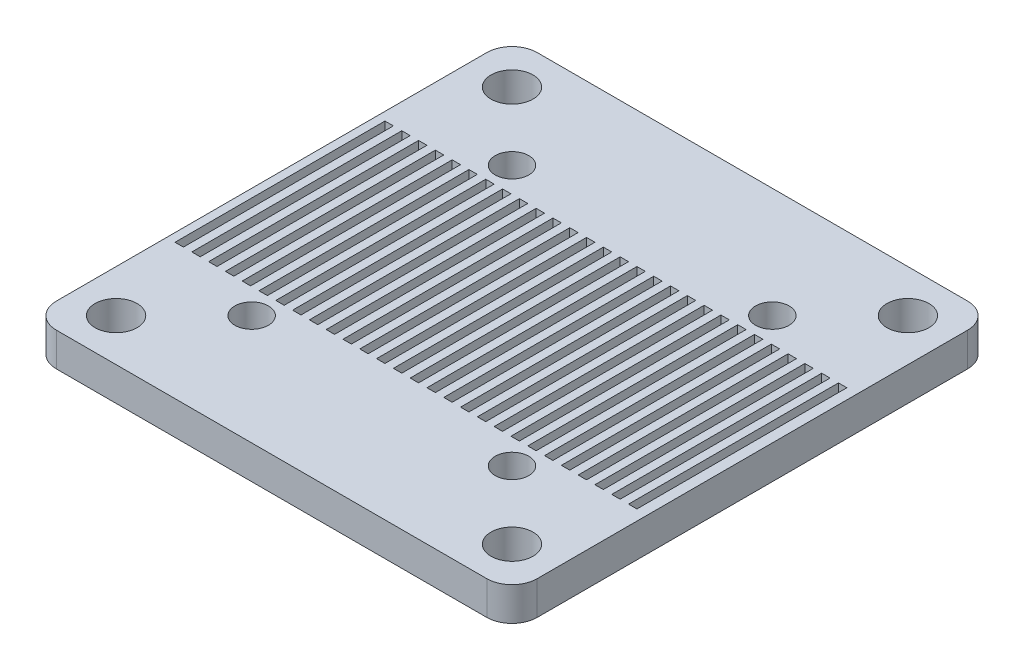
from build123d import *

# Parameters (mm, degrees)
SKETCH1_R           = 2
SKETCH1_R_2         = 2.5
BOSS_EXTRUDE1_DEPTH = 4
SKETCH2_W           = 1
SKETCH2_H           = 25
CUT_EXTRUDE1_DEPTH  = 1


with BuildPart() as part:
    # Sketch1 → Boss-Extrude1 (new body)
    with BuildSketch(Plane(origin=(0, 0, 0), x_dir=(1, 0, 0), z_dir=(0, 1, 0))):
        with BuildLine():
            Line((25.625, 28.625), (-25.625, 28.625))
            ThreePointArc((-25.625, 28.625), (-27.746320344, 27.746320344), (-28.625, 25.625))
            Line((-28.625, 25.625), (-28.625, -25.625))
            ThreePointArc((-28.625, -25.625), (-27.746320344, -27.746320344), (-25.625, -28.625))
            Line((-25.625, -28.625), (25.625, -28.625))
            ThreePointArc((25.625, -28.625), (27.746320344, -27.746320344), (28.625, -25.625))
            Line((28.625, -25.625), (28.625, 25.625))
            ThreePointArc((28.625, 25.625), (27.746320344, 27.746320344), (25.625, 28.625))
        make_face()
        with Locations(Location((-15.5, 15.5, 0), (0, 0, 270))):
            Circle(SKETCH1_R, mode=Mode.SUBTRACT)
        with Locations(Location((-23.57, 23.57, 0), (0, 0, 270))):
            Circle(SKETCH1_R_2, mode=Mode.SUBTRACT)
        with Locations(Location((23.57, 23.57, 0), (0, 0, 270))):
            Circle(SKETCH1_R_2, mode=Mode.SUBTRACT)
        with Locations(Location((15.5, 15.5, 0), (0, 0, 270))):
            Circle(SKETCH1_R, mode=Mode.SUBTRACT)
        with Locations(Location((15.5, -15.5, 0), (0, 0, 270))):
            Circle(SKETCH1_R, mode=Mode.SUBTRACT)
        with Locations(Location((-15.5, -15.5, 0), (0, 0, 270))):
            Circle(SKETCH1_R, mode=Mode.SUBTRACT)
        with Locations(Location((-23.57, -23.57, 0), (0, 0, 270))):
            Circle(SKETCH1_R_2, mode=Mode.SUBTRACT)
        with Locations(Location((23.57, -23.57, 0), (0, 0, 270))):
            Circle(SKETCH1_R_2, mode=Mode.SUBTRACT)
    extrude(amount=BOSS_EXTRUDE1_DEPTH)

    # Sketch2 → Cut-Extrude1 (cut)
    with BuildSketch(Plane(origin=(0, 4, 0), x_dir=(1, 0, 0), z_dir=(0, 1, 0))):
        with Locations((-27.125, 0)):
            Rectangle(SKETCH2_W, SKETCH2_H)
        with Locations((-25.125, 0)):
            Rectangle(SKETCH2_W, SKETCH2_H)
        with Locations((-23.125, 0)):
            Rectangle(SKETCH2_W, SKETCH2_H)
        with Locations((-21.125, 0)):
            Rectangle(SKETCH2_W, SKETCH2_H)
        with Locations((-19.125, 0)):
            Rectangle(SKETCH2_W, SKETCH2_H)
        with Locations((-17.125, 0)):
            Rectangle(SKETCH2_W, SKETCH2_H)
        with Locations((-15.125, 0)):
            Rectangle(SKETCH2_W, SKETCH2_H)
        with Locations((-13.125, 0)):
            Rectangle(SKETCH2_W, SKETCH2_H)
        with Locations((-11.125, 0)):
            Rectangle(SKETCH2_W, SKETCH2_H)
        with Locations((-9.125, 0)):
            Rectangle(SKETCH2_W, SKETCH2_H)
        with Locations((-7.125, 0)):
            Rectangle(SKETCH2_W, SKETCH2_H)
        with Locations((-5.125, 0)):
            Rectangle(SKETCH2_W, SKETCH2_H)
        with Locations((-3.125, 0)):
            Rectangle(SKETCH2_W, SKETCH2_H)
        with Locations((-1.125, 0)):
            Rectangle(SKETCH2_W, SKETCH2_H)
        with Locations((0.875, 0)):
            Rectangle(SKETCH2_W, SKETCH2_H)
        with Locations((2.875, 0)):
            Rectangle(SKETCH2_W, SKETCH2_H)
        with Locations((4.875, 0)):
            Rectangle(SKETCH2_W, SKETCH2_H)
        with Locations((6.875, 0)):
            Rectangle(SKETCH2_W, SKETCH2_H)
        with Locations((8.875, 0)):
            Rectangle(SKETCH2_W, SKETCH2_H)
        with Locations((10.875, 0)):
            Rectangle(SKETCH2_W, SKETCH2_H)
        with Locations((12.875, 0)):
            Rectangle(SKETCH2_W, SKETCH2_H)
        with Locations((14.875, 0)):
            Rectangle(SKETCH2_W, SKETCH2_H)
        with Locations((16.875, 0)):
            Rectangle(SKETCH2_W, SKETCH2_H)
        with Locations((18.875, 0)):
            Rectangle(SKETCH2_W, SKETCH2_H)
        with Locations((20.875, 0)):
            Rectangle(SKETCH2_W, SKETCH2_H)
        with Locations((22.875, 0)):
            Rectangle(SKETCH2_W, SKETCH2_H)
        with Locations((24.875, 0)):
            Rectangle(SKETCH2_W, SKETCH2_H)
        with Locations((26.875, 0)):
            Rectangle(SKETCH2_W, SKETCH2_H)
    extrude(amount=-CUT_EXTRUDE1_DEPTH, mode=Mode.SUBTRACT)


solid = part.part
